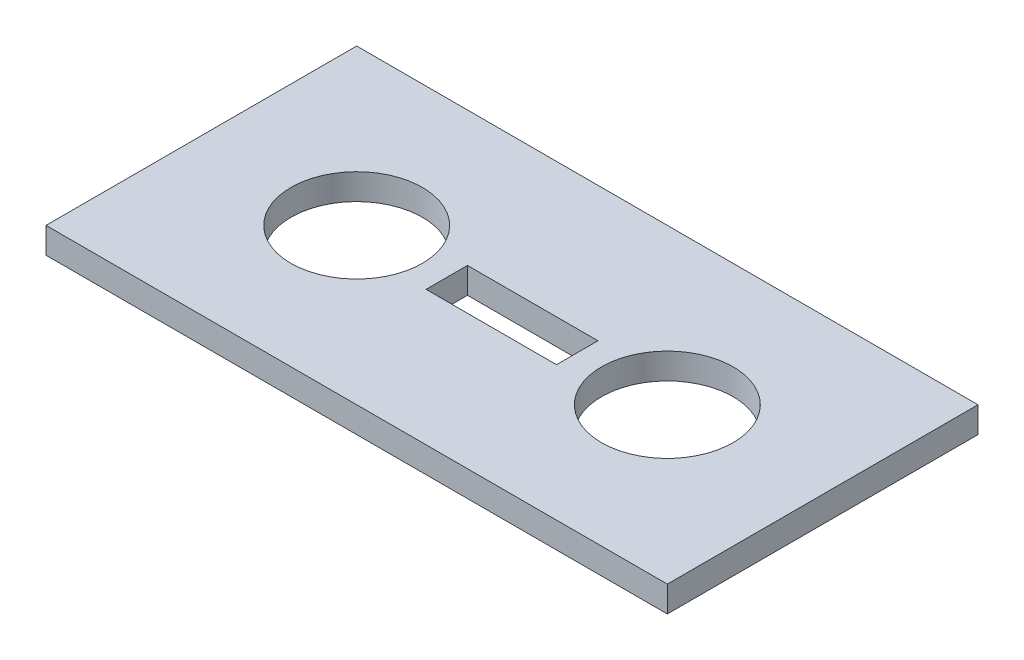
from build123d import *

# Parameters (mm, degrees)
BOSS_EXTRUDE1_DEPTH       = 0.3175
F_0_CLEARANCE_HOLE1_D     = 1.6129
F_0_CLEARANCE_HOLE1_DEPTH = 6.35
F_0_CLEARANCE_HOLE1_TIP   = 0.676691898


with BuildPart() as part:
    # Sketch1 → Boss-Extrude1 (new body)
    with BuildSketch(Plane(origin=(0, 0, 0), x_dir=(1, 0, 0), z_dir=(0, 1, 0))):
        with BuildLine():
            ThreePointArc((1.736526379, 0), (1.905, 0.168473621), (2.073473621, 0))
            Line((2.073473621, 0), (3.81, 0))
            Line((3.81, 0), (3.81, 1.905))
            Line((3.81, 1.905), (-3.81, 1.905))
            Line((-3.81, 1.905), (-3.81, 0))
            Line((-3.81, 0), (-2.064971223, 0))
            ThreePointArc((-2.064971223, 0), (-1.905, 0.159971223), (-1.745028777, 0))
            Line((-1.745028777, 0), (-0.8, 0))
            Line((-0.8, 0), (-0.8, 0.254))
            Line((-0.8, 0.254), (0.8, 0.254))
            Line((0.8, 0.254), (0.8, 0))
            Line((0.8, 0), (1.736526379, 0))
        make_face()
        with BuildLine():
            Line((3.81, 0), (2.073473621, 0))
            ThreePointArc((2.073473621, 0), (1.905, -0.168473621), (1.736526379, 0))
            Line((1.736526379, 0), (0.8, 0))
            Line((0.8, 0), (0.8, -0.254))
            Line((0.8, -0.254), (-0.8, -0.254))
            Line((-0.8, -0.254), (-0.8, 0))
            Line((-0.8, 0), (-1.745028777, 0))
            ThreePointArc((-1.745028777, 0), (-1.905, -0.159971223), (-2.064971223, 0))
            Line((-2.064971223, 0), (-3.81, 0))
            Line((-3.81, 0), (-3.81, -1.905))
            Line((-3.81, -1.905), (3.81, -1.905))
            Line((3.81, -1.905), (3.81, 0))
        make_face()
    extrude(amount=BOSS_EXTRUDE1_DEPTH)

    # #0 Clearance Hole1
    with Locations(Plane(origin=(-1.905, 0.3175, 0), x_dir=(0, 0, 1), z_dir=(0, 1, 0))):
        with Locations((0, 0), (0, 3.81)):
            Hole(F_0_CLEARANCE_HOLE1_D / 2, depth=F_0_CLEARANCE_HOLE1_DEPTH)
            with Locations((0, 0, -(F_0_CLEARANCE_HOLE1_DEPTH + F_0_CLEARANCE_HOLE1_TIP / 2))):  # 100° drill point
                Cone(0, F_0_CLEARANCE_HOLE1_D / 2, F_0_CLEARANCE_HOLE1_TIP, mode=Mode.SUBTRACT)


solid = part.part
